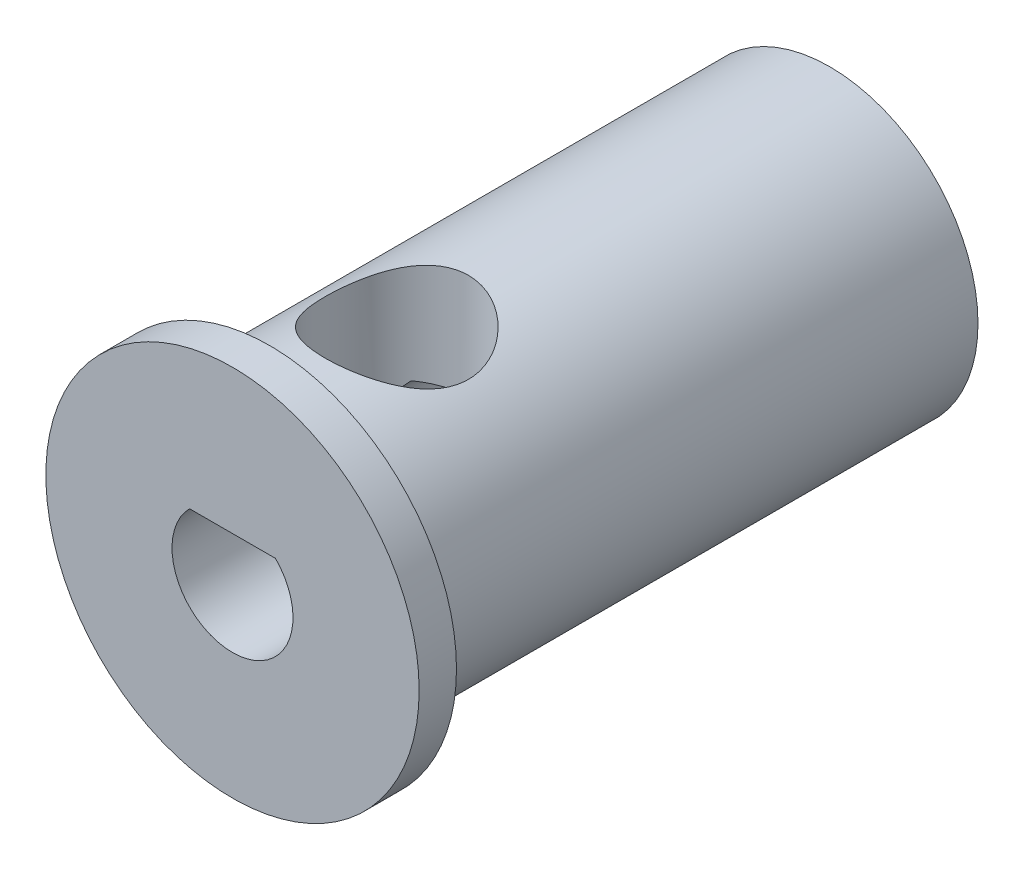
from build123d import *

# Parameters (mm, degrees)
SKETCH2_R           = 5.0419
SKETCH2_R_2         = 2.0574
BOSS_EXTRUDE1_DEPTH = 19.05
BOSS_EXTRUDE2_DEPTH = 19.05
SKETCH3_R           = 2.4384
CUT_EXTRUDE1_DEPTH  = 12.7
SKETCH4_W           = 1.27
SKETCH4_H           = 6.35
CUT_EXTRUDE2_DEPTH  = 22.060567509


with BuildPart() as part:
    # Sketch2 → Boss-Extrude1 (new body)
    with BuildSketch(Plane.XY):
        with Locations(Location((0, 0, 0), (0, 0, 180))):
            Circle(SKETCH2_R)
        with Locations(Location((0, 0, 0), (0, 0, 180))):
            Circle(SKETCH2_R_2, mode=Mode.SUBTRACT)
    extrude(amount=BOSS_EXTRUDE1_DEPTH)

    # Sketch6 → Boss-Extrude2 (add)
    with BuildSketch(Plane(origin=(0, 0, 0), x_dir=(-1, 0, 0), z_dir=(0, 0, -1))):
        with BuildLine():
            Line((1.461769448, 1.4478), (-1.461769448, 1.4478))
            ThreePointArc((-1.461769448, 1.4478), (0, 2.0574), (1.461769448, 1.4478))
        make_face()
    extrude(amount=-BOSS_EXTRUDE2_DEPTH)

    # Sketch3 → Cut-Extrude1 (cut, symmetric)
    with BuildSketch(Plane.XZ):
        with Locations(Location((0, 14.732, 0), (0, 0, 270))):
            Circle(SKETCH3_R)
    extrude(amount=CUT_EXTRUDE1_DEPTH, both=True, mode=Mode.SUBTRACT)

    # Sketch4 → Revolve1 (revolve)
    with BuildSketch(Plane(origin=(0, 0, 0), x_dir=(0, 0, -1), z_dir=(1, 0, 0)), mode=Mode.PRIVATE) as revolve1_sk:
        with Locations((-19.685, 3.175)):
            Rectangle(SKETCH4_W, SKETCH4_H)
    revolve(revolve1_sk.sketch.rotate(Axis((0, 0, 0), (0, 0, -1)), 90), axis=Axis((0, 0, 0), (0, 0, -1)))

    # Sketch5 → Cut-Extrude2 (cut, through all)
    with BuildSketch(Plane(origin=(0, 0, 19.05), x_dir=(-1, 0, 0), z_dir=(0, 0, -1))):
        with BuildLine():
            Line((1.461769448, 1.4478), (-1.461769448, 1.4478))
            ThreePointArc((-1.461769448, 1.4478), (0, -2.0574), (1.461769448, 1.4478))
        make_face()
    extrude(amount=-CUT_EXTRUDE2_DEPTH, mode=Mode.SUBTRACT)


solid = part.part
